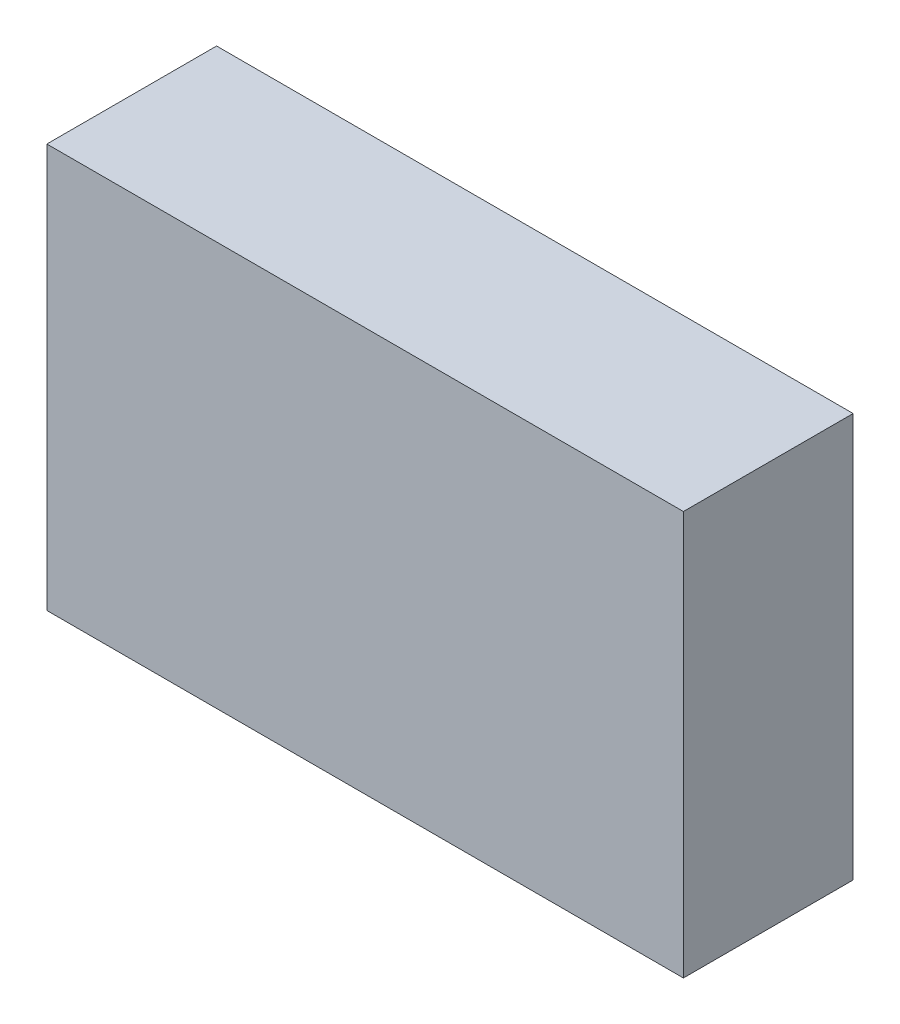
from build123d import *

# Parameters (mm, degrees)
SKETCH_1_W      = 75
SKETCH_1_H      = 47.6
EXTRUDE_1_DEPTH = 20


with BuildPart() as part:
    # 草图1 → 凸台-拉伸1 (new body)
    with BuildSketch(Plane.XY):
        Rectangle(SKETCH_1_W, SKETCH_1_H)
    extrude(amount=EXTRUDE_1_DEPTH)


solid = part.part
